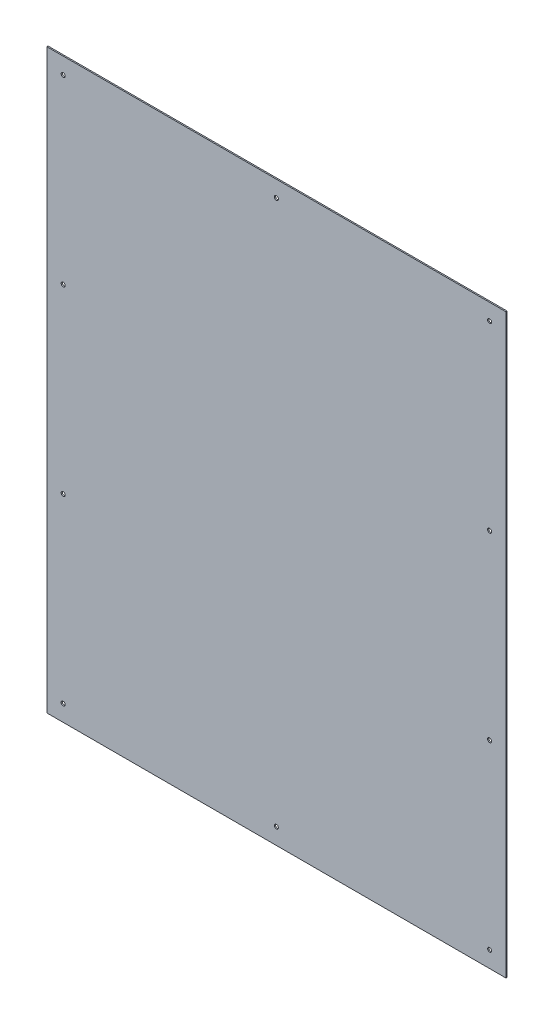
from build123d import *

# Parameters (mm, degrees)
CROQUIS1_W              = 716
CROQUIS1_H              = 900
SALIENTE_EXTRUIR1_DEPTH = 1.9
CROQUIS2_R              = 3.175
CORTAR_EXTRUIR1_DEPTH   = 10


with BuildPart() as part:
    # Croquis1 → Saliente-Extruir1 (new body)
    with BuildSketch(Plane.XY):
        Rectangle(CROQUIS1_W, CROQUIS1_H)
    extrude(amount=SALIENTE_EXTRUIR1_DEPTH)

    # Croquis2 → Cortar-Extruir1 (cut)
    with BuildSketch(Plane.XY.offset(1.9)):
        with Locations((-332.6, 424.6)):
            Circle(CROQUIS2_R)
        with Locations((332.6, 424.6)):
            Circle(CROQUIS2_R)
        with Locations((0, 424.6)):
            Circle(CROQUIS2_R)
        with Locations((332.6, -424.6)):
            Circle(CROQUIS2_R)
        with Locations((0, -424.6)):
            Circle(CROQUIS2_R)
        with Locations((-332.6, -424.6)):
            Circle(CROQUIS2_R)
        with Locations((-332.6, 141.54)):
            Circle(CROQUIS2_R)
        with Locations((-332.6, -141.52)):
            Circle(CROQUIS2_R)
        with Locations((332.6, -141.52)):
            Circle(CROQUIS2_R)
        with Locations((332.6, 141.54)):
            Circle(CROQUIS2_R)
    extrude(amount=-CORTAR_EXTRUIR1_DEPTH, mode=Mode.SUBTRACT)


solid = part.part
